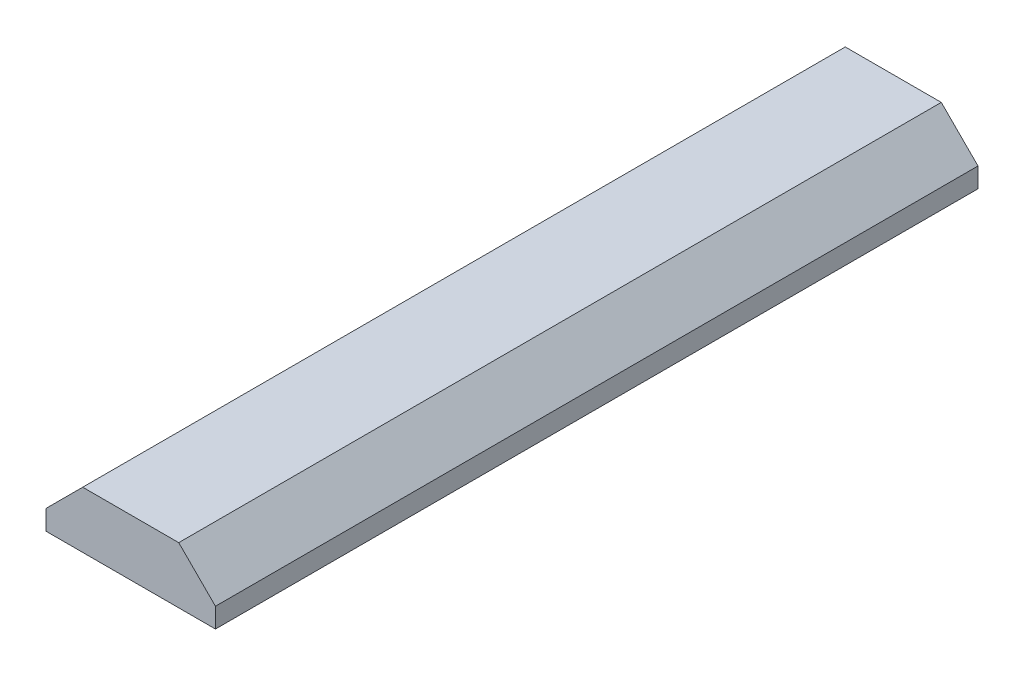
from build123d import *

# Parameters (mm, degrees)
AUFSATZ_LINEAR_AUSTRAGEN1_DEPTH = 54


with BuildPart() as part:
    # Skizze1 → Aufsatz-Linear austragen1 (new body)
    with BuildSketch(Plane.XY):
        Polygon((3.4, 1.808858787), (-3.4, 1.808858787), (-6, -0.791141213), (-6, -2.191141213), (6, -2.191141213), (6, -0.791141213), align=None)
    extrude(amount=AUFSATZ_LINEAR_AUSTRAGEN1_DEPTH)


solid = part.part
